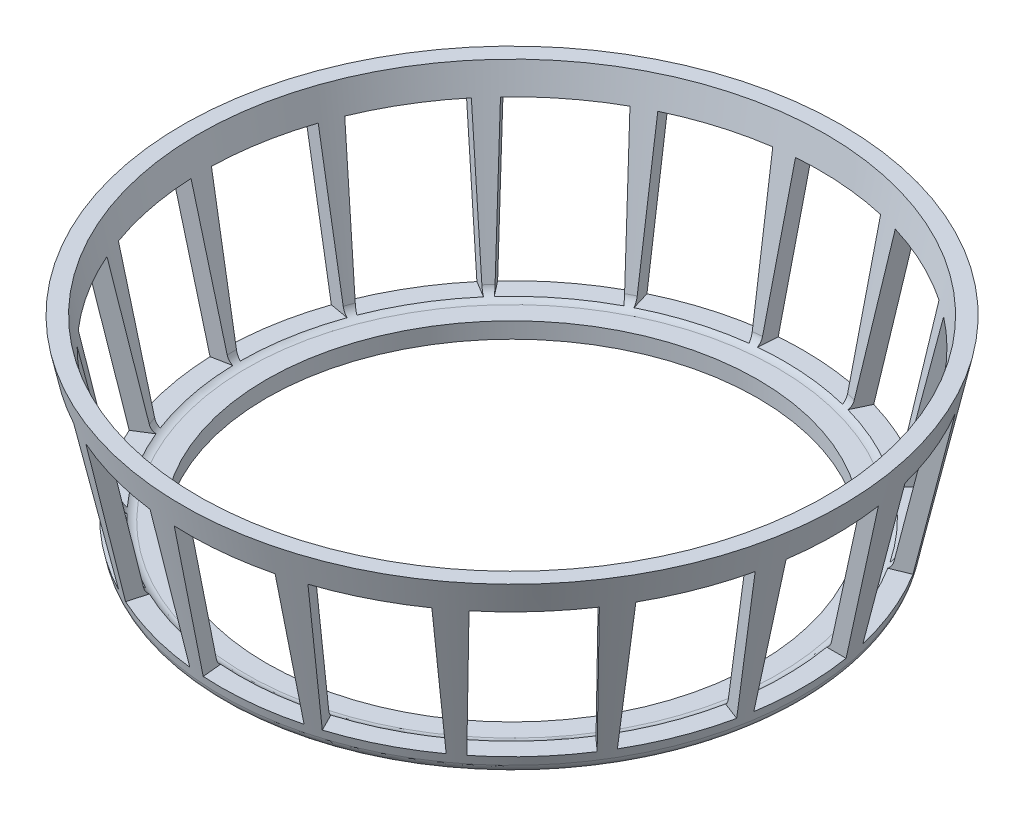
from build123d import *

# Parameters (mm, degrees)
IZIM3_W                 = 12.244333929
IZIM3_H                 = 12.35
KES_EKSTR_ZYON1_DEPTH   = 3.85
DAIRESEL_KAPLAMA1_COUNT = 17
DAIRESEL_KAPLAMA1_ANGLE = 337.6


with BuildPart() as part:
    # Çizim1 → Döndür1 (revolve)
    with BuildSketch(Plane.XY, mode=Mode.PRIVATE) as d_nd_r1_sk:
        with BuildLine():
            Line((-26.17, 16.23), (-23.127004679, 2.119195982))
            ThreePointArc((-23.127004679, 2.119195982), (-22.777646685, 1.551924163), (-22.149476333, 1.33))
            Line((-22.149476333, 1.33), (-20.5, 1.33))
            Line((-20.5, 1.33), (-20.5, 0))
            Line((-20.5, 0), (-23.192661792, 0))
            ThreePointArc((-23.192661792, 0), (-23.820832144, 0.221924163), (-24.170190138, 0.789195982))
            Line((-24.170190138, 0.789195982), (-27.5, 16.23))
            Line((-27.5, 16.23), (-26.17, 16.23))
        make_face()
    revolve(d_nd_r1_sk.sketch.rotate(Axis((0, 0, 0), (0, 1, 0)), 270), axis=Axis((0, 0, 0), (0, 1, 0)))

    # Çizim3 → Kes-Ekstrüzyon1 (cut, symmetric)
    with BuildSketch(Plane.XY):
        with Locations((25.802262366, 7.695)):
            Rectangle(IZIM3_W, IZIM3_H)
    kes_ekstr_zyon1 = extrude(amount=KES_EKSTR_ZYON1_DEPTH, both=True, mode=Mode.SUBTRACT)

    # Dairesel Kaplama1: Kes-Ekstrüzyon1 ×17 about axis
    dairesel_kaplama1_axis = Axis((0, 0, 0), (0, -1, 0))
    for i in range(1, DAIRESEL_KAPLAMA1_COUNT):
        add(kes_ekstr_zyon1.rotate(dairesel_kaplama1_axis, i * DAIRESEL_KAPLAMA1_ANGLE / (DAIRESEL_KAPLAMA1_COUNT - 1)), mode=Mode.SUBTRACT)


solid = part.part
